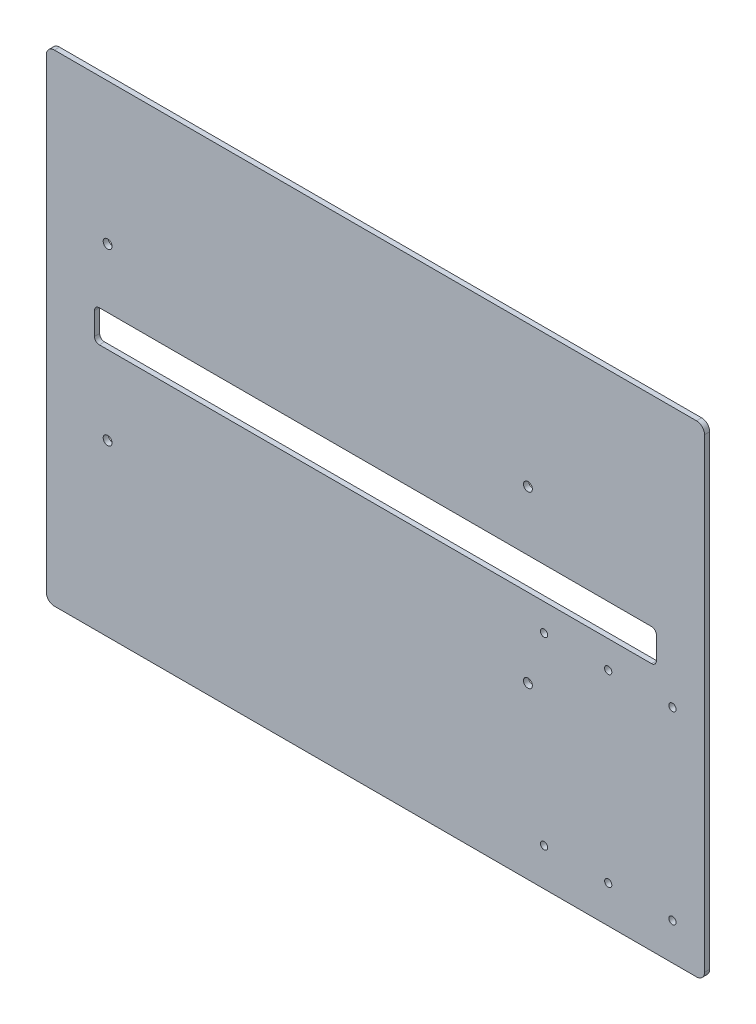
from build123d import *

# Parameters (mm, degrees)
SKETCH1_R           = 2.25
SKETCH1_R_2         = 2.75
BOSS_EXTRUDE1_DEPTH = 3.2


with BuildPart() as part:
    # Sketch1 → Boss-Extrude1 (new body)
    with BuildSketch(Plane.XY):
        with BuildLine():
            Line((5, 0), (405, 0))
            ThreePointArc((405, 0), (408.535533906, 1.464466094), (410, 5))
            Line((410, 5), (410, 295))
            ThreePointArc((410, 295), (408.535533906, 298.535533906), (405, 300))
            Line((405, 300), (5, 300))
            ThreePointArc((5, 300), (1.464466094, 298.535533906), (0, 295))
            Line((0, 295), (0, 5))
            ThreePointArc((0, 5), (1.464466094, 1.464466094), (5, 0))
        make_face()
        with Locations((310, 23.339430176)):
            Circle(SKETCH1_R, mode=Mode.SUBTRACT)
        with Locations((350, 23.156887411)):
            Circle(SKETCH1_R, mode=Mode.SUBTRACT)
        with Locations((390, 22.974344646)):
            Circle(SKETCH1_R, mode=Mode.SUBTRACT)
        with Locations((310, 137.974344646)):
            Circle(SKETCH1_R, mode=Mode.SUBTRACT)
        with Locations((350, 137.974344646)):
            Circle(SKETCH1_R, mode=Mode.SUBTRACT)
        with Locations((390, 137.974344646)):
            Circle(SKETCH1_R, mode=Mode.SUBTRACT)
        with Locations((300, 106)):
            Circle(SKETCH1_R_2, mode=Mode.SUBTRACT)
        with Locations((38.17, 106)):
            Circle(SKETCH1_R_2, mode=Mode.SUBTRACT)
        with Locations((38.17, 212)):
            Circle(SKETCH1_R_2, mode=Mode.SUBTRACT)
        with Locations((300, 212)):
            Circle(SKETCH1_R_2, mode=Mode.SUBTRACT)
        with BuildLine():
            Line((33, 155), (377, 155))
            ThreePointArc((377, 155), (379.121320344, 155.878679656), (380, 158))
            Line((380, 158), (380, 172))
            ThreePointArc((380, 172), (379.121320344, 174.121320344), (377, 175))
            Line((377, 175), (33, 175))
            ThreePointArc((33, 175), (30.878679656, 174.121320344), (30, 172))
            Line((30, 172), (30, 158))
            ThreePointArc((30, 158), (30.878679656, 155.878679656), (33, 155))
        make_face(mode=Mode.SUBTRACT)
    extrude(amount=BOSS_EXTRUDE1_DEPTH)


solid = part.part
